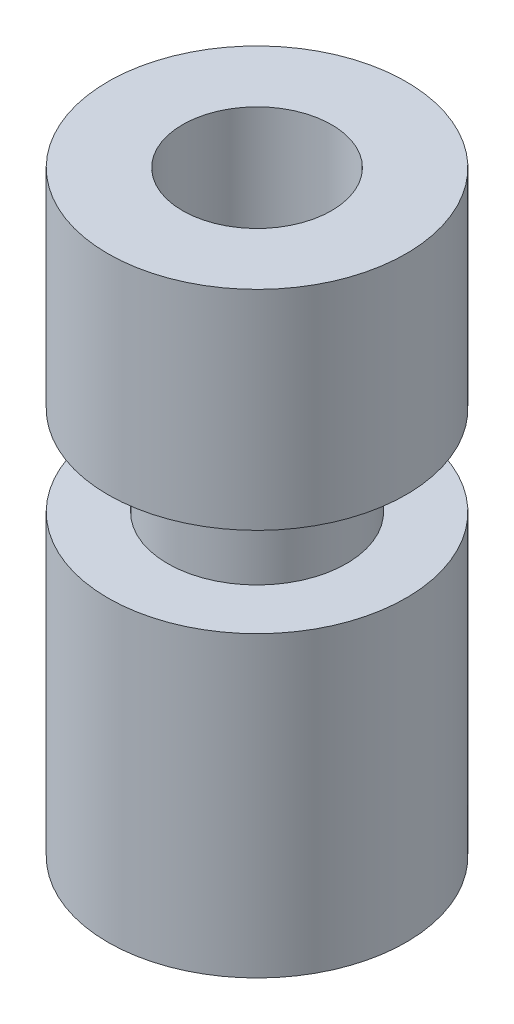
from build123d import *

# Parameters (mm, degrees)
SKETCH1_R           = 2.5
BOSS_EXTRUDE1_DEPTH = 5
SKETCH2_R           = 1.5
BOSS_EXTRUDE2_DEPTH = 1.5
SKETCH3_R           = 2.5
BOSS_EXTRUDE3_DEPTH = 3.5
SKETCH4_R           = 1.25
CUT_EXTRUDE1_DEPTH  = 2


with BuildPart() as part:
    # Sketch1 → Boss-Extrude1 (new body)
    with BuildSketch(Plane(origin=(0, 0, 0), x_dir=(1, 0, 0), z_dir=(0, 1, 0))):
        with Locations(Location((0, 0, 0), (0, 0, 270))):
            Circle(SKETCH1_R)
    extrude(amount=BOSS_EXTRUDE1_DEPTH)

    # Sketch2 → Boss-Extrude2 (add)
    with BuildSketch(Plane(origin=(0, 5, 0), x_dir=(1, 0, 0), z_dir=(0, 1, 0))):
        with Locations(Location((0, 0, 0), (0, 0, 270))):
            Circle(SKETCH2_R)
    extrude(amount=BOSS_EXTRUDE2_DEPTH)

    # Sketch3 → Boss-Extrude3 (add)
    with BuildSketch(Plane(origin=(0, 6.5, 0), x_dir=(1, 0, 0), z_dir=(0, 1, 0))):
        with Locations(Location((0, 0, 0), (0, 0, 270))):
            Circle(SKETCH3_R)
    extrude(amount=BOSS_EXTRUDE3_DEPTH)

    # Sketch4 → Cut-Extrude1 (cut)
    with BuildSketch(Plane(origin=(0, 10, 0), x_dir=(1, 0, 0), z_dir=(0, 1, 0))):
        with Locations(Location((0, 0, 0), (0, 0, 270))):
            Circle(SKETCH4_R)
    extrude(amount=-CUT_EXTRUDE1_DEPTH, mode=Mode.SUBTRACT)


solid = part.part
